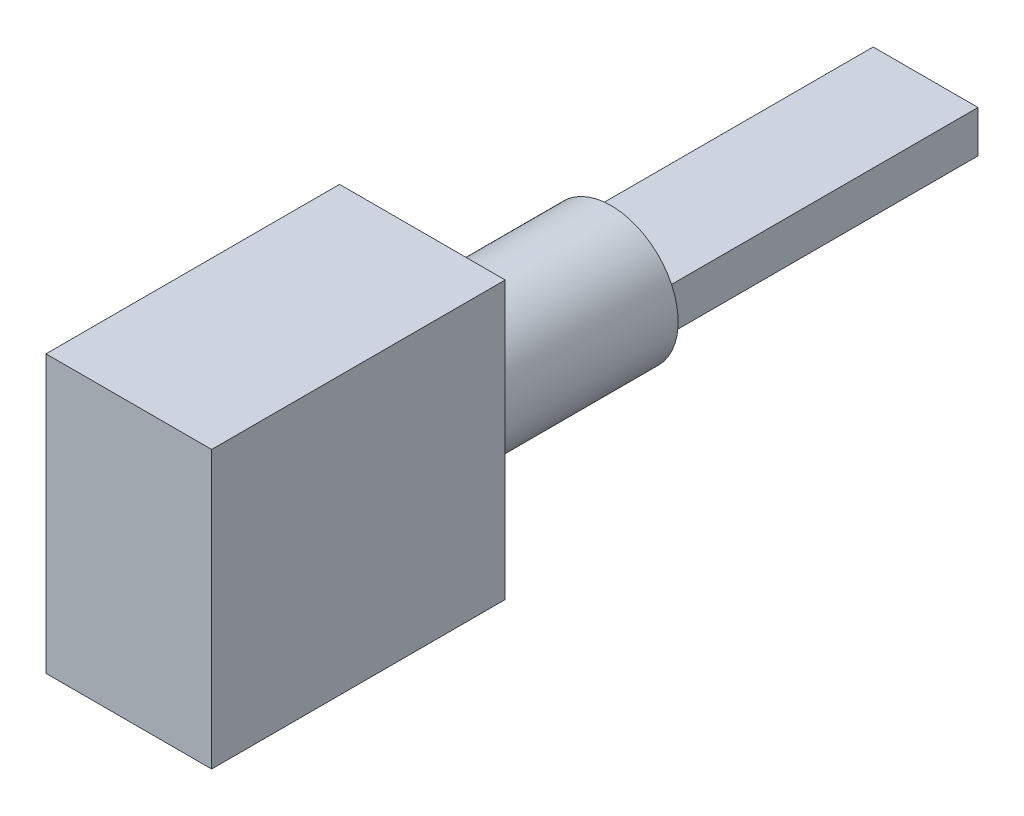
from build123d import *

# Parameters (mm, degrees)
SKETCH_1_W      = 7.9
SKETCH_1_H      = 13.2
EXTRUDE_1_DEPTH = 14
SKETCH_2_R      = 3.2
EXTRUDE_2_DEPTH = 9
SKETCH_3_W      = 5
SKETCH_3_H      = 2
EXTRUDE_3_DEPTH = 15


with BuildPart() as part:
    # 草圖1 → 填料-伸長1 (new body)
    with BuildSketch(Plane.XY):
        with Locations((-28.615519845, -65.707444045)):
            Rectangle(SKETCH_1_W, SKETCH_1_H)
    extrude(amount=EXTRUDE_1_DEPTH)

    # 草圖2 → 填料-伸長2 (add)
    with BuildSketch(Plane(origin=(0, 0, 0), x_dir=(-1, 0, 0), z_dir=(0, 0, -1))):
        with Locations((28.615519845, -65.707444045)):
            Circle(SKETCH_2_R)
    extrude(amount=EXTRUDE_2_DEPTH)

    # 草圖3 → 填料-伸長3 (add)
    with BuildSketch(Plane(origin=(0, 0, -9), x_dir=(-1, 0, 0), z_dir=(0, 0, -1))):
        with Locations((28.615519845, -65.707444045)):
            Rectangle(SKETCH_3_W, SKETCH_3_H)
    extrude(amount=EXTRUDE_3_DEPTH)


solid = part.part
